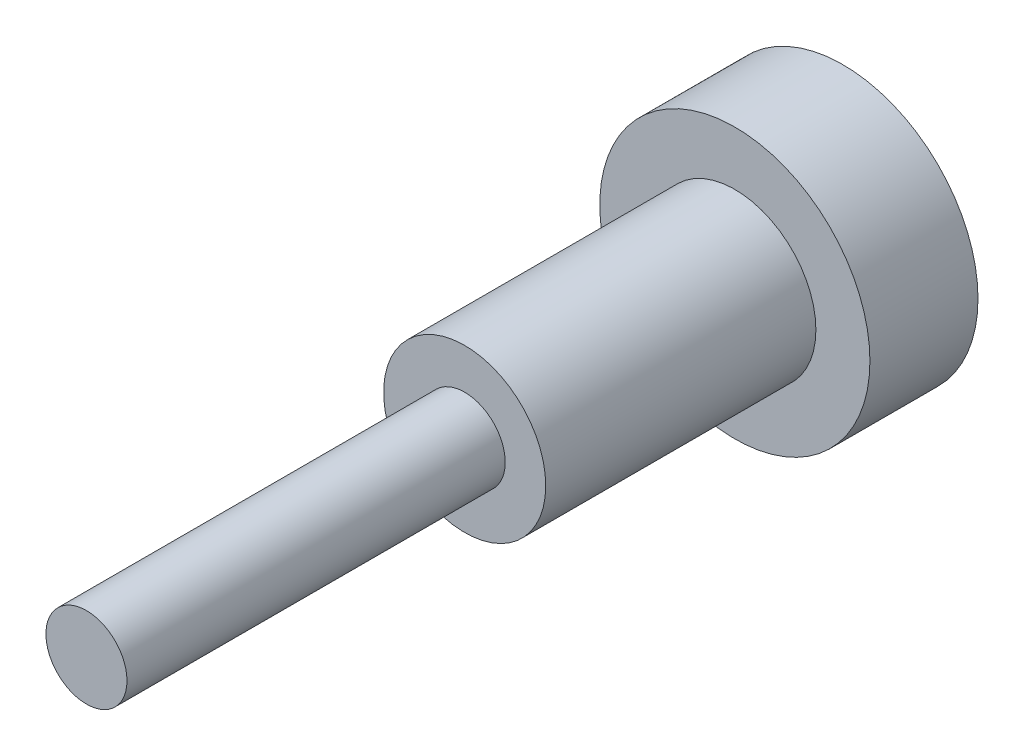
from build123d import *

# Parameters (mm, degrees)
SKETCH1_R           = 0.75
BOSS_EXTRUDE1_DEPTH = 12
SKETCH1_3_R         = 1.5
SKETCH1_3_R_2       = 0.75
BOSS_EXTRUDE2_DEPTH = 5
SKETCH1_4_R         = 2.5
BOSS_EXTRUDE3_DEPTH = 2


with BuildPart() as part:
    # Sketch1 → Boss-Extrude1 (new body)
    with BuildSketch(Plane.XY):
        Circle(SKETCH1_R)
    extrude(amount=BOSS_EXTRUDE1_DEPTH)

    # Sketch1<3> → Boss-Extrude2 (add)
    with BuildSketch(Plane.XY):
        Circle(SKETCH1_3_R)
        Circle(SKETCH1_3_R_2, mode=Mode.SUBTRACT)
    extrude(amount=BOSS_EXTRUDE2_DEPTH)

    # Sketch1<4> → Boss-Extrude3 (add)
    with BuildSketch(Plane.XY):
        Circle(SKETCH1_4_R)
    extrude(amount=-BOSS_EXTRUDE3_DEPTH)


solid = part.part
